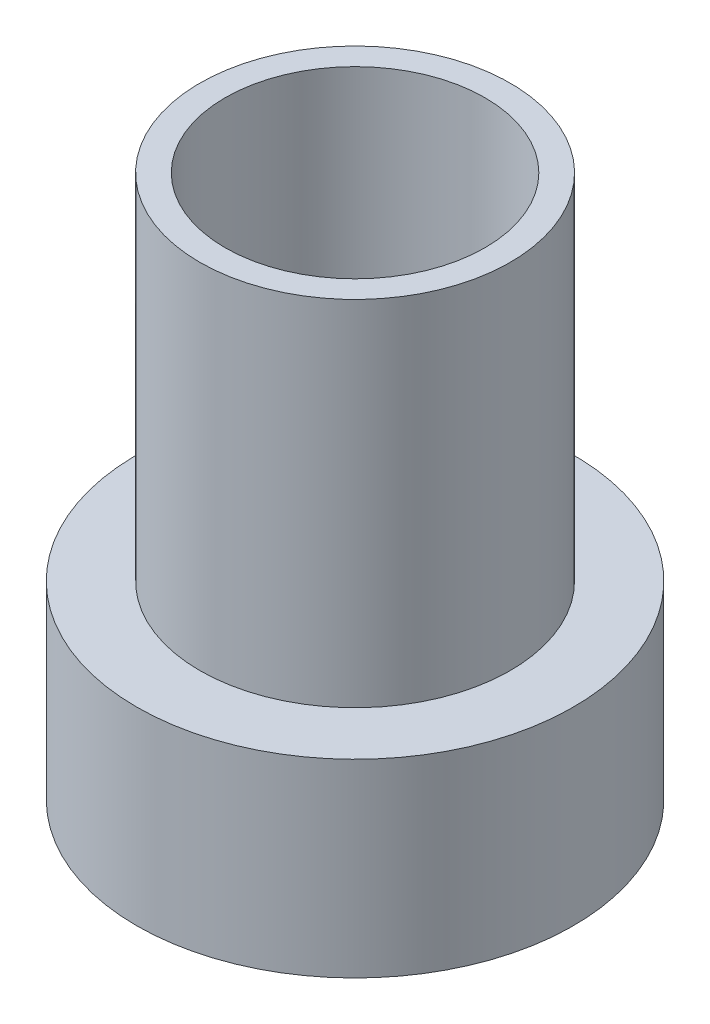
from build123d import *

# Parameters (mm, degrees)
SKETCH1_R           = 4.15
SKETCH1_R_2         = 2.95
BOSS_EXTRUDE1_DEPTH = 3.6
SKETCH1_3_R         = 2.95
SKETCH1_3_R_2       = 2.47
BOSS_EXTRUDE2_DEPTH = 10.32
CHAMFER1_SIZE       = 1.75
CHAMFER1_SIZE2      = 1.318719588


with BuildPart() as part:
    # Sketch1 → Boss-Extrude1 (new body)
    with BuildSketch(Plane(origin=(0, 0, 0), x_dir=(1, 0, 0), z_dir=(0, 1, 0))):
        Circle(SKETCH1_R)
        Circle(SKETCH1_R_2, mode=Mode.SUBTRACT)
    extrude(amount=BOSS_EXTRUDE1_DEPTH)

    # Sketch1<3> → Boss-Extrude2 (add)
    with BuildSketch(Plane(origin=(0, 0, 0), x_dir=(1, 0, 0), z_dir=(0, 1, 0))):
        Circle(SKETCH1_3_R)
        Circle(SKETCH1_3_R_2, mode=Mode.SUBTRACT)
    extrude(amount=BOSS_EXTRUDE2_DEPTH)

    # Chamfer1
    chamfer1_edges = [part.edges().sort_by_distance(p)[0] for p in [
        (-2.47, 0, 0),
    ]]
    chamfer1_side = [part.faces().sort_by_distance(p)[0] for p in [
        (-2.47, 5.16, 0),
    ]]
    chamfer(chamfer1_edges, length=CHAMFER1_SIZE, length2=CHAMFER1_SIZE2, reference=chamfer1_side[0])


solid = part.part
